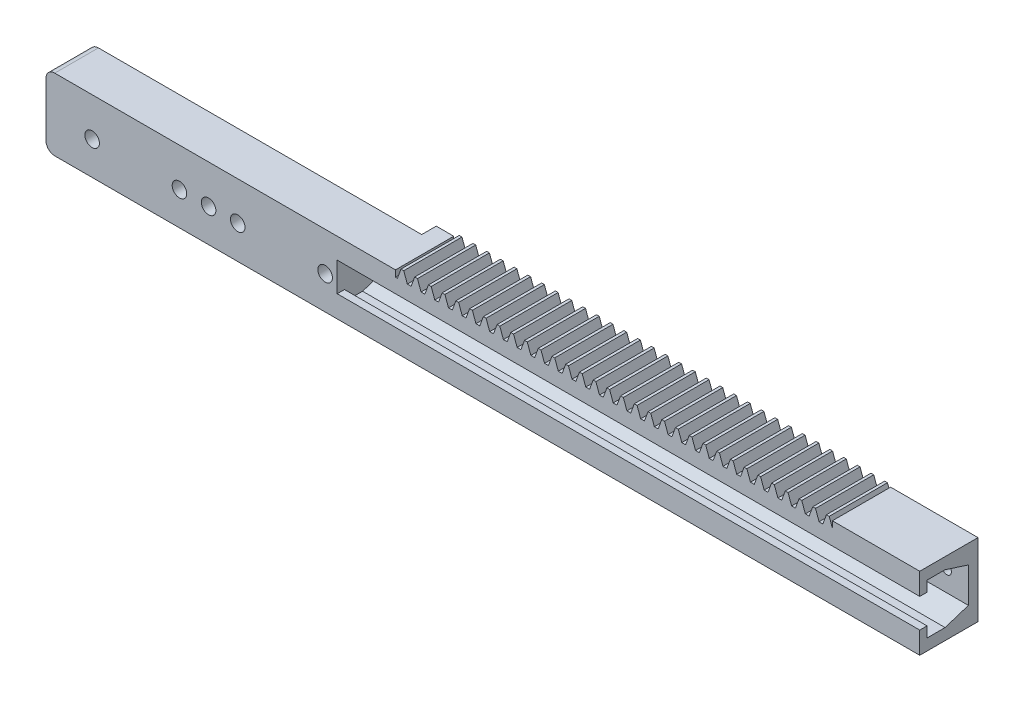
from build123d import *

# Parameters (mm, degrees)
BLANKSKE_W              = 150
BLANKSKE_H              = 11.5
BLANK_DEPTH             = 20
TOOTHCUTSIM_DEPTH       = 152.763796737
TEETHCUTS_COUNT         = 33
TEETHCUTS_PITCH         = 4.712388975
BOSS_EXTRUDE1_DEPTH     = 20
BOSS_EXTRUDE2_DEPTH     = 20
SKETCH3_W               = 190
SKETCH3_H               = 20
BOSS_EXTRUDE3_DEPTH     = 14.285
CUT_EXTRUDE1_DEPTH      = 192.583040024
SKETCH6_W               = 20
SKETCH6_H               = 24.61
BOSS_EXTRUDE4_DEPTH     = 140
BOSS_EXTRUDE5_DEPTH     = 10
SKETCH9_R               = 2.5
CUT_EXTRUDE2_DEPTH      = 182.670199056
CUT_EXTRUDE5_DEPTH      = 341.88716788
CUT_EXTRUDE5_DEPTH_BACK = 154
SKETCH15_W              = 2.5
SKETCH15_H              = 15
BOSS_EXTRUDE9_DEPTH     = 10
SKETCH16_R              = 2
CUT_EXTRUDE7_DEPTH      = 10
SKETCH17_W              = 15
SKETCH17_H              = 10
CUT_EXTRUDE8_DEPTH      = 177
SKETCH20_W              = 15
SKETCH20_H              = 24.61
CUT_EXTRUDE9_DEPTH      = 40
FILLET2_R               = 3
SKETCH21_R              = 1.6
CUT_EXTRUDE10_DEPTH     = 40


with BuildPart() as part:
    # BlankSke → Blank (new body)
    with BuildSketch(Plane.XY):
        with Locations((75, 5.75)):
            Rectangle(BLANKSKE_W, BLANKSKE_H)
    extrude(amount=-BLANK_DEPTH)

    # TooCutSkeSim → ToothCutSim (cut, through all)
    with BuildSketch(Plane.XY):
        Polygon((0.654653055, 8.125), (-0.654653055, 8.125), (-1.892297439, 11.5254), (1.892297439, 11.5254), align=None)
    toothcutsim = extrude(amount=-TOOTHCUTSIM_DEPTH, mode=Mode.SUBTRACT)

    # TeethCuts: ToothCutSim ×33
    with Locations(*[(i * TEETHCUTS_PITCH, 0, 0) for i in range(1, TEETHCUTS_COUNT)]):
        add(toothcutsim, mode=Mode.SUBTRACT)

    # Sketch1 → Boss-Extrude1 (add)
    with BuildSketch(Plane(origin=(150, 0, 0), x_dir=(0, 0, -1), z_dir=(1, 0, 0))):
        Polygon((0, 8.514576213), (0, 10.714576213), (20, 10.714576213), (20, 0), (0, 0), align=None)
    extrude(amount=BOSS_EXTRUDE1_DEPTH)

    # Sketch2 → Boss-Extrude2 (add)
    with BuildSketch(Plane.ZY):
        Polygon((-20, 8.125), (-20, 10.325), (0, 10.325), (0, 0), (-20, 0), align=None)
    extrude(amount=BOSS_EXTRUDE2_DEPTH)

    # Sketch3 → Boss-Extrude3 (add)
    with BuildSketch(Plane.XZ):
        with Locations((75, -10)):
            Rectangle(SKETCH3_W, SKETCH3_H)
    extrude(amount=BOSS_EXTRUDE3_DEPTH)

    # Sketch4 → Cut-Extrude1 (cut, through all)
    with BuildSketch(Plane(origin=(170, 0, 0), x_dir=(0, 0, -1), z_dir=(1, 0, 0))):
        Polygon((2.5, -6.785211894), (2.5, -10.385211894), (8.7, -10.385211894), (16.7, -7.785211894), (16.7, -1.785211894), (16.7, 4.214788106), (8.7, 6.814788106), (2.5, 6.814788106), (2.5, 3.214788106), (0, 3.214788106), (0, -1.785211894), (0, -6.785211894), align=None)
    extrude(amount=-CUT_EXTRUDE1_DEPTH, mode=Mode.SUBTRACT)

    # Sketch6 → Boss-Extrude4 (add)
    with BuildSketch(Plane.ZY.offset(20)):
        with Locations((-10, -1.98)):
            Rectangle(SKETCH6_W, SKETCH6_H)
    extrude(amount=BOSS_EXTRUDE4_DEPTH)

    # Sketch8 → Boss-Extrude5 (add)
    with BuildSketch(Plane(origin=(170, 0, 0), x_dir=(0, 0, -1), z_dir=(1, 0, 0))):
        Polygon((20, 10.714576213), (20, -14.285), (0, -14.285), (0, -6.785211894), (2.5, -6.785211894), (2.5, -10.385211894), (8.7, -10.385211894), (16.7, -7.785211894), (16.7, 4.214788106), (8.7, 6.814788106), (2.5, 6.814788106), (2.5, 3.214788106), (0, 3.214788106), (0, 10.714576213), align=None)
    extrude(amount=BOSS_EXTRUDE5_DEPTH)

    # Sketch9 → Cut-Extrude2 (cut, through all)
    with BuildSketch(Plane(origin=(0, 0, -20), x_dir=(-1, 0, 0), z_dir=(0, 0, -1))):
        with Locations((24.169323408, -2.889762756)):
            Circle(SKETCH9_R)
        with Locations((54.169323408, -2.889762756)):
            Circle(SKETCH9_R)
        with Locations((64.169323408, -2.889762756)):
            Circle(SKETCH9_R)
        with Locations((74.169323408, -2.889762756)):
            Circle(SKETCH9_R)
        with Locations((104.169323408, -2.889762756)):
            Circle(SKETCH9_R)
    extrude(amount=-CUT_EXTRUDE2_DEPTH, mode=Mode.SUBTRACT)

    # Sketch10 → Cut-Extrude5 (cut, two sides: drawn at the far end of the back side and taken through both)
    with BuildSketch(Plane.ZY.offset(160).offset(-CUT_EXTRUDE5_DEPTH_BACK)):
        Polygon((-20, -14.285), (-15, -14.285), (-15, 10.325), (-15, 11.5), (-20, 11.5), (-20, 10.325), align=None)
    extrude(amount=CUT_EXTRUDE5_DEPTH + CUT_EXTRUDE5_DEPTH_BACK, mode=Mode.SUBTRACT)

    # Sketch15 → Boss-Extrude9 (add)
    with BuildSketch(Plane.XZ.offset(14.285)):
        with Locations((-11.17642258, -7.5)):
            Rectangle(SKETCH15_W, SKETCH15_H)
    extrude(amount=BOSS_EXTRUDE9_DEPTH)

    # Sketch16 → Cut-Extrude7 (cut)
    with BuildSketch(Plane.ZY.offset(12.42642258)):
        with Locations((-11.25, -19.285)):
            Circle(SKETCH16_R)
        with Locations((-3.75, -19.285)):
            Circle(SKETCH16_R)
    extrude(amount=-CUT_EXTRUDE7_DEPTH, mode=Mode.SUBTRACT)

    # Sketch17 → Cut-Extrude8 (cut)
    with BuildSketch(Plane.ZY.offset(160)):
        with Locations((-7.5, -19.285)):
            Rectangle(SKETCH17_W, SKETCH17_H)
    extrude(amount=-CUT_EXTRUDE8_DEPTH, mode=Mode.SUBTRACT)

    # Sketch20 → Cut-Extrude9 (cut)
    with BuildSketch(Plane.ZY.offset(160)):
        with Locations((-7.5, -1.98)):
            Rectangle(SKETCH20_W, SKETCH20_H)
    extrude(amount=-CUT_EXTRUDE9_DEPTH, mode=Mode.SUBTRACT)

    # Fillet2
    fillet2_edges = [part.edges().sort_by_distance(p)[0] for p in [
        (-120, -14.285, -7.5),
        (-120, 10.325, -7.5),
    ]]
    fillet(fillet2_edges, radius=FILLET2_R)

    # Sketch21 → Cut-Extrude10 (cut)
    with BuildSketch(Plane(origin=(0, 0, -20), x_dir=(-1, 0, 0), z_dir=(0, 0, -1))):
        with Locations((-172.560963077, -0.785239005)):
            Circle(SKETCH21_R)
        with Locations((-162.560967794, -0.785233109)):
            Circle(SKETCH21_R)
    extrude(amount=-CUT_EXTRUDE10_DEPTH, mode=Mode.SUBTRACT)


solid = part.part
